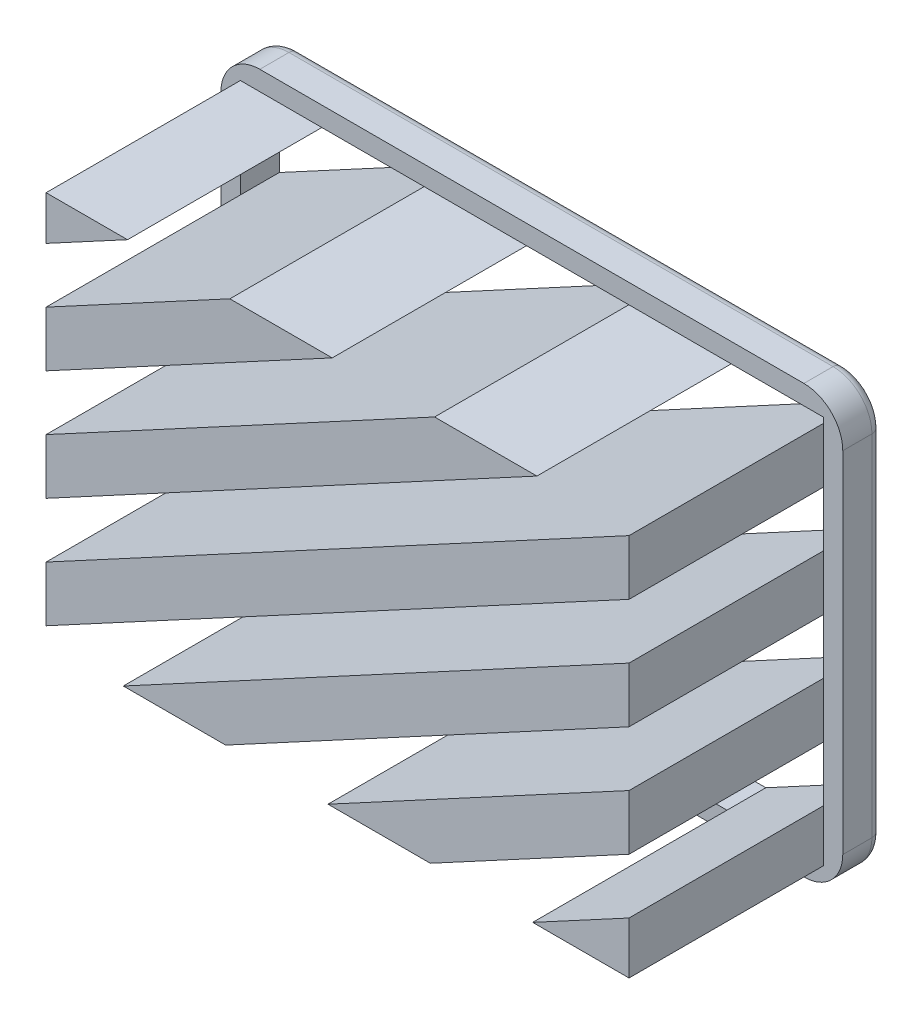
from build123d import *

# Parameters (mm, degrees)
SKETCH_1_W          = 35
SKETCH_1_H          = 25
EXTRUDE_1_DEPTH     = 12
CUT_EXTRUDE_1_DEPTH = 12
SKETCH_3_W          = 35
SKETCH_3_H          = 25
CUT_EXTRUDE_2_DEPTH = 10
FILLET_1_R          = 3
FILLET_2_R          = 0.5
SKETCH_4_W          = 32
SKETCH_4_H          = 22
CUT_EXTRUDE_3_DEPTH = 10
FILLET_3_R          = 2
FILLET_4_R          = 0.5


with BuildPart() as part:
    # 草图1 → 凸台-拉伸1 (new body)
    with BuildSketch(Plane.XY):
        with Locations((-0.028271405, -3.933764136)):
            Rectangle(SKETCH_1_W, SKETCH_1_H)
    extrude(amount=EXTRUDE_1_DEPTH)

    # 草图2 → 切除-拉伸1 (cut)
    with BuildSketch(Plane(origin=(0, 0, 0), x_dir=(-1, 0, 0), z_dir=(0, 0, -1))):
        Polygon((10.837079767, 6.066235864), (5.570103523, 6.066235864), (15.028271405, 0.96567043), (15.028271405, 3.806025698), align=None)
        Polygon((0.303127279, 6.066235864), (-4.963848965, 6.066235864), (15.028271405, -4.715040108), (15.028271405, -1.874684839), align=None)
        Polygon((-10.23082521, 6.066235864), (-14.971728595, 6.066235864), (-14.971728595, 5.782537258), (15.028271405, -10.395750645), (15.028271405, -7.555395376), align=None)
        Polygon((15.028271405, -13.236105913), (-14.971728595, 2.94218199), (-14.971728595, 0.101826721), (11.054988709, -13.933764136), (15.028271405, -13.933764136), align=None)
        Polygon((5.788012464, -13.933764136), (-14.971728595, -2.738528547), (-14.971728595, -5.578883816), (0.52103622, -13.933764136), align=None)
        Polygon((-4.745940024, -13.933764136), (-14.971728595, -8.419239085), (-14.971728595, -11.259594353), (-10.012916268, -13.933764136), align=None)
    extrude(amount=-CUT_EXTRUDE_1_DEPTH, mode=Mode.SUBTRACT)

    # 草图3 → 切除-拉伸2 (cut)
    with BuildSketch(Plane.XY.offset(12)):
        with Locations((-0.028271405, -3.933764136)):
            Rectangle(SKETCH_3_W, SKETCH_3_H)
        Polygon((10.23082521, 6.066235864), (14.971728595, 6.066235864), (14.971728595, 5.782537258), (14.971728595, 2.94218199), (14.971728595, 0.101826721), (14.971728595, -2.738528547), (14.971728595, -5.578883816), (14.971728595, -8.419239085), (14.971728595, -11.259594353), (14.971728595, -13.933764136), (10.012916268, -13.933764136), (4.745940024, -13.933764136), (-0.52103622, -13.933764136), (-5.788012464, -13.933764136), (-11.054988709, -13.933764136), (-15.028271405, -13.933764136), (-15.028271405, -13.236105913), (-15.028271405, -10.395750645), (-15.028271405, -7.555395376), (-15.028271405, -4.715040108), (-15.028271405, -1.874684839), (-15.028271405, 0.96567043), (-15.028271405, 3.806025698), (-15.028271405, 6.066235864), (-10.837079767, 6.066235864), (-5.570103523, 6.066235864), (-0.303127279, 6.066235864), (4.963848965, 6.066235864), align=None, mode=Mode.SUBTRACT)
    extrude(amount=-CUT_EXTRUDE_2_DEPTH, mode=Mode.SUBTRACT)

    # 圆角1
    fillet_1_edges = [part.edges().sort_by_distance(p)[0] for p in [
        (-17.528271405, 8.566235864, 1),
        (17.471728595, 8.566235864, 1),
        (17.471728595, -16.433764136, 1),
        (-17.528271405, -16.433764136, 1),
    ]]
    fillet(fillet_1_edges, radius=FILLET_1_R)

    # 圆角2
    fillet_2_edges = [part.edges().sort_by_distance(p)[0] for p in [
        (17.471728595, -3.933764136, 0),
        (-17.528271405, -3.933764136, 0),
        (-0.028271405, 8.566235864, 0),
        (-0.028271405, -16.433764136, 0),
        (16.593048938, 7.687556208, 0),
        (-16.649591749, 7.687556208, 0),
        (-16.649591749, -15.555084479, 0),
        (16.593048938, -15.555084479, 0),
    ]]
    fillet(fillet_2_edges, radius=FILLET_2_R)

    # 草图4 → 切除-拉伸3 (cut)
    with BuildSketch(Plane.XY.offset(2)):
        with BuildLine():
            ThreePointArc((-17.528271405, -13.433764136), (-16.649591749, -15.555084479), (-14.528271405, -16.433764136))
            Line((-14.528271405, -16.433764136), (14.471728595, -16.433764136))
            ThreePointArc((14.471728595, -16.433764136), (16.593048938, -15.555084479), (17.471728595, -13.433764136))
            Line((17.471728595, -13.433764136), (17.471728595, 5.566235864))
            ThreePointArc((17.471728595, 5.566235864), (16.593048938, 7.687556208), (14.471728595, 8.566235864))
            Line((14.471728595, 8.566235864), (-14.528271405, 8.566235864))
            ThreePointArc((-14.528271405, 8.566235864), (-16.649591749, 7.687556208), (-17.528271405, 5.566235864))
            Line((-17.528271405, 5.566235864), (-17.528271405, -13.433764136))
        make_face()
        with Locations((-0.028271405, -3.933764136)):
            Rectangle(SKETCH_4_W, SKETCH_4_H, mode=Mode.SUBTRACT)
    extrude(amount=-CUT_EXTRUDE_3_DEPTH, mode=Mode.SUBTRACT)

    # 圆角3
    fillet_3_edges = [part.edges().sort_by_distance(p)[0] for p in [
        (15.971728595, 7.066235864, 1),
        (-16.028271405, 7.066235864, 1),
        (-16.028271405, -14.933764136, 1),
        (15.971728595, -14.933764136, 1),
    ]]
    fillet(fillet_3_edges, radius=FILLET_3_R)

    # 圆角4
    fillet_4_edges = [part.edges().sort_by_distance(p)[0] for p in [
        (15.971728595, -3.933764136, 0),
        (-0.028271405, 7.066235864, 0),
        (-16.028271405, -3.933764136, 0),
        (-0.028271405, -14.933764136, 0),
        (15.385942157, -14.347977698, 0),
        (-15.442484968, -14.347977698, 0),
        (-15.442484968, 6.480449427, 0),
        (15.385942157, 6.480449427, 0),
    ]]
    fillet(fillet_4_edges, radius=FILLET_4_R)


solid = part.part
